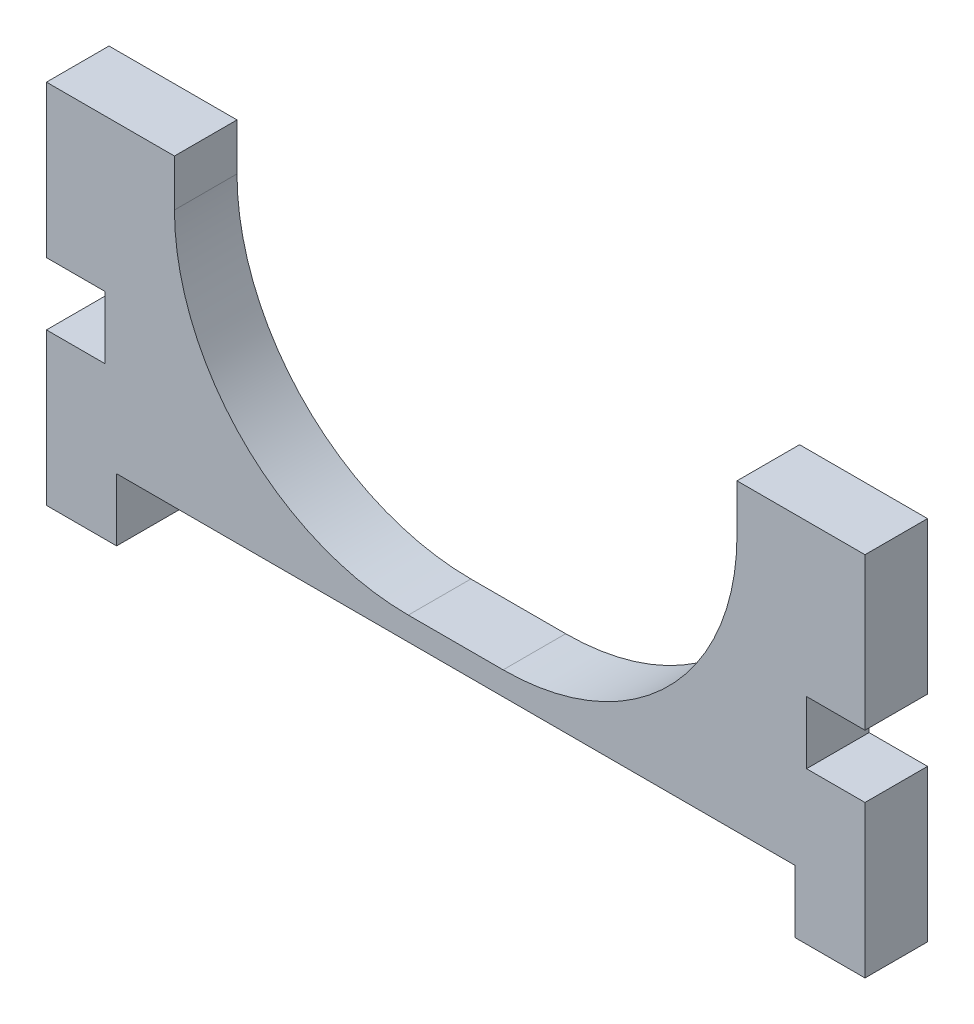
from build123d import *

# Parameters (mm, degrees)
BOSS_EXTRUDE1_DEPTH = 5.35


with BuildPart() as part:
    # Model → Boss-Extrude1 (new body)
    with BuildSketch(Plane.XY):
        with BuildLine():
            Line((39.055, 7.35), (30.945, 7.35))
            ThreePointArc((30.945, 7.35), (16.802864376, 13.207864376), (10.945, 27.35))
            Line((10.945, 27.35), (10.945, 31.35))
            Line((10.945, 31.35), (0, 31.35))
            Line((0, 31.35), (0, 18.35))
            Line((0, 18.35), (5, 18.35))
            Line((5, 18.35), (5, 13))
            Line((5, 13), (0, 13))
            Line((0, 13), (0, 0))
            Line((0, 0), (6, 0))
            Line((6, 0), (6, 5.35))
            Line((6, 5.35), (64, 5.35))
            Line((64, 5.35), (64, 0))
            Line((64, 0), (70, 0))
            Line((70, 0), (70, 13))
            Line((70, 13), (65, 13))
            Line((65, 13), (65, 18.35))
            Line((65, 18.35), (70, 18.35))
            Line((70, 18.35), (70, 31.35))
            Line((70, 31.35), (59.055, 31.35))
            Line((59.055, 31.35), (59.055, 27.35))
            ThreePointArc((59.055, 27.35), (53.197135624, 13.207864376), (39.055, 7.35))
        make_face()
    extrude(amount=BOSS_EXTRUDE1_DEPTH)


solid = part.part
